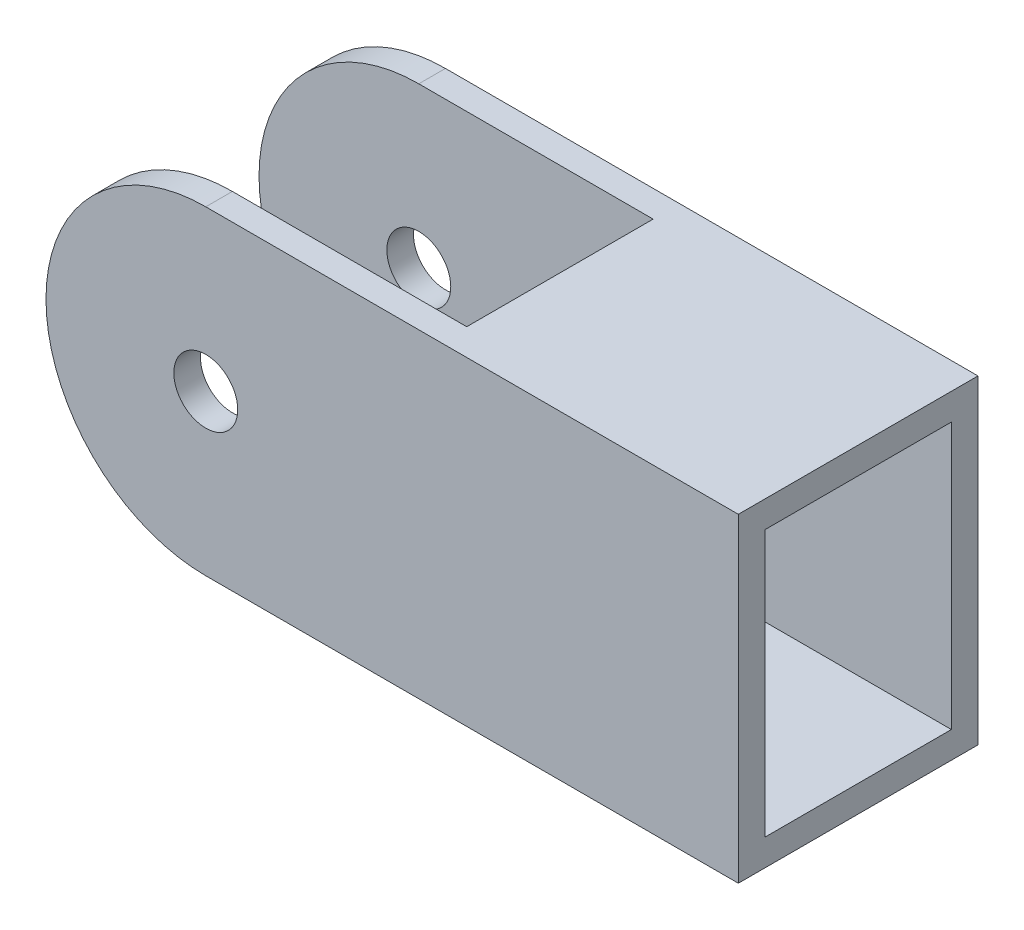
from build123d import *

# Parameters (mm, degrees)
DODANIE_WYCI_GNI_CIE1_DEPTH = 5
SZKIC2_W                    = 56
SZKIC2_H                    = 35
DODANIE_WYCI_GNI_CIE2_DEPTH = 5
SZKIC3_R                    = 6
WYTNIJ_WYCI_GNI_CIE1_DEPTH  = 97.566039579


with BuildPart() as part:
    # Szkic1 → Dodanie-wyciągnięcie1 (new body)
    with BuildSketch(Plane.XY):
        with BuildLine():
            Line((-50, -30), (50, -30))
            Line((50, -30), (50, 30))
            Line((50, 30), (-50, 30))
            ThreePointArc((-50, 30), (-80, 0), (-50, -30))
        make_face()
    extrude(amount=DODANIE_WYCI_GNI_CIE1_DEPTH)


with BuildPart() as body_2:
    # Lustro2: mirrored copy
    add(part.part.mirror(Plane.XY.offset(22.5)))


with BuildPart() as part_1:
    add(part.part)

    add(body_2.part)  # Dodanie-wyciągnięcie2 merges body 2
    # Szkic2 → Dodanie-wyciągnięcie2 (add)
    with BuildSketch(Plane(origin=(0, 30, 0), x_dir=(1, 0, 0), z_dir=(0, 1, 0))):
        with Locations((22, -22.5)):
            Rectangle(SZKIC2_W, SZKIC2_H)
    dodanie_wyci_gni_cie2 = extrude(amount=-DODANIE_WYCI_GNI_CIE2_DEPTH)

    # Lustro3: Dodanie-wyciągnięcie2 across plane
    add(dodanie_wyci_gni_cie2.mirror(Plane.ZX))

    # Szkic3 → Wytnij-wyciągnięcie1 (cut, through all)
    with BuildSketch(Plane.XY.offset(45)):
        with Locations((-50, 0)):
            Circle(SZKIC3_R)
    extrude(amount=-WYTNIJ_WYCI_GNI_CIE1_DEPTH, mode=Mode.SUBTRACT)


solid = part_1.part
